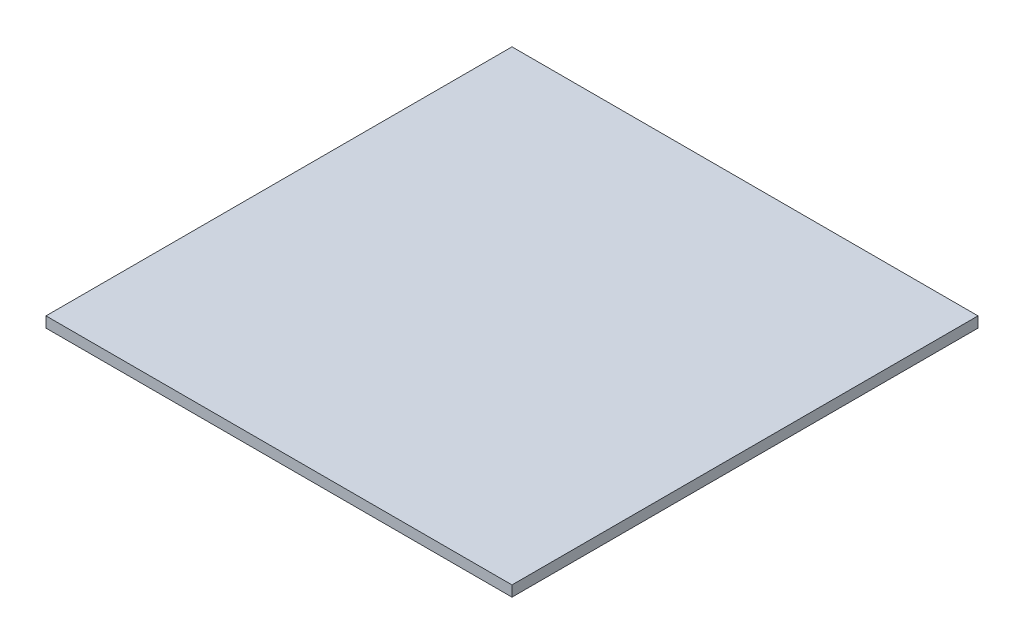
from build123d import *

# Parameters (mm, degrees)
SKETCH1_W           = 219
SKETCH1_H           = 219
BOSS_EXTRUDE1_DEPTH = 5


with BuildPart() as part:
    # Sketch1 → Boss-Extrude1 (new body)
    with BuildSketch(Plane(origin=(0, 0, 0), x_dir=(1, 0, 0), z_dir=(0, 1, 0))):
        Rectangle(SKETCH1_W, SKETCH1_H)
    extrude(amount=BOSS_EXTRUDE1_DEPTH)


solid = part.part
